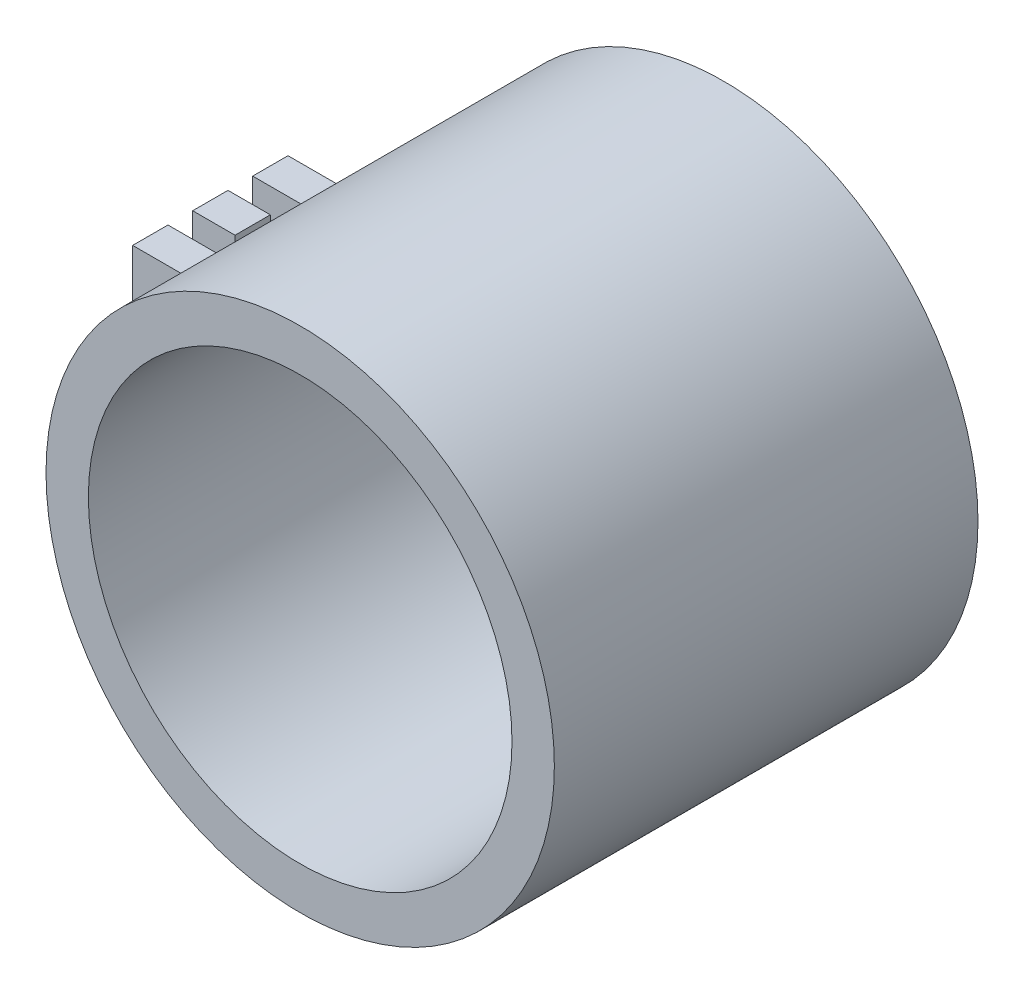
from build123d import *

# Parameters (mm, degrees)
SKETCH1_R                = 36
BOSS_EXTRUDE1_DEPTH      = 60
SKETCH2_R                = 30
CUT_EXTRUDE1_DEPTH       = 60
BOSS_EXTRUDE2_START      = -5
BOSS_EXTRUDE2_DEPTH      = 5
BOSS_EXTRUDE4_DEPTH      = 2.5
BOSS_EXTRUDE4_DEPTH_BACK = 2.5
SKETCH7_R                = 2.5
CUT_EXTRUDE2_DEPTH       = 70.300236124


with BuildPart() as part:
    # Sketch1 → Boss-Extrude1 (new body)
    with BuildSketch(Plane.XY):
        Circle(SKETCH1_R)
    extrude(amount=BOSS_EXTRUDE1_DEPTH)

    # Sketch2 → Cut-Extrude1 (cut)
    with BuildSketch(Plane.XY.offset(60)):
        Circle(SKETCH2_R)
    extrude(amount=-CUT_EXTRUDE1_DEPTH, mode=Mode.SUBTRACT)

    # Sketch5 → Boss-Extrude2 (add)
    with BuildSketch(Plane.XY.offset(24).offset(BOSS_EXTRUDE2_START)):
        with BuildLine():
            Line((-32.726136344, 15), (-42.726136344, 15))
            Line((-42.726136344, 15), (-42.726136344, 0))
            Line((-42.726136344, 0), (-42.726136344, -6))
            Line((-42.726136344, -6), (-36.726136344, -6))
            Line((-36.726136344, -6), (-36.726136344, 11.726443556))
            Line((-36.726136344, 11.726443556), (-34.036605611, 11.726443556))
            ThreePointArc((-34.036605611, 11.726443556), (-33.421474703, 13.379276091), (-32.726136344, 15))
        make_face()
    boss_extrude2 = extrude(amount=BOSS_EXTRUDE2_DEPTH)

    # Mirror1: Boss-Extrude2 across plane
    add(boss_extrude2.mirror(Plane.XY.offset(30)))

    # Sketch6 → Boss-Extrude4 (add, two sides: drawn at the far end of the back side and taken through both)
    with BuildSketch(Plane.XY.offset(30).offset(-BOSS_EXTRUDE4_DEPTH_BACK)):
        with BuildLine():
            Line((-36.726136344, 15), (-42.726136344, 15))
            Line((-42.726136344, 15), (-42.726136344, -6))
            Line((-42.726136344, -6), (-32.726136344, -6))
            ThreePointArc((-32.726136344, -6), (-33.421474703, -4.379276091), (-34.036605611, -2.726443556))
            Line((-34.036605611, -2.726443556), (-36.726136344, -2.726443556))
            Line((-36.726136344, -2.726443556), (-36.726136344, 15))
        make_face()
    extrude(amount=BOSS_EXTRUDE4_DEPTH + BOSS_EXTRUDE4_DEPTH_BACK)

    # Sketch7 → Cut-Extrude2 (cut, through all)
    with BuildSketch(Plane.XY.offset(41)):
        with Locations(Location((-39.726136344, -1, 0), (0, 0, 180))):
            Circle(SKETCH7_R)
    extrude(amount=-CUT_EXTRUDE2_DEPTH, mode=Mode.SUBTRACT)


solid = part.part
